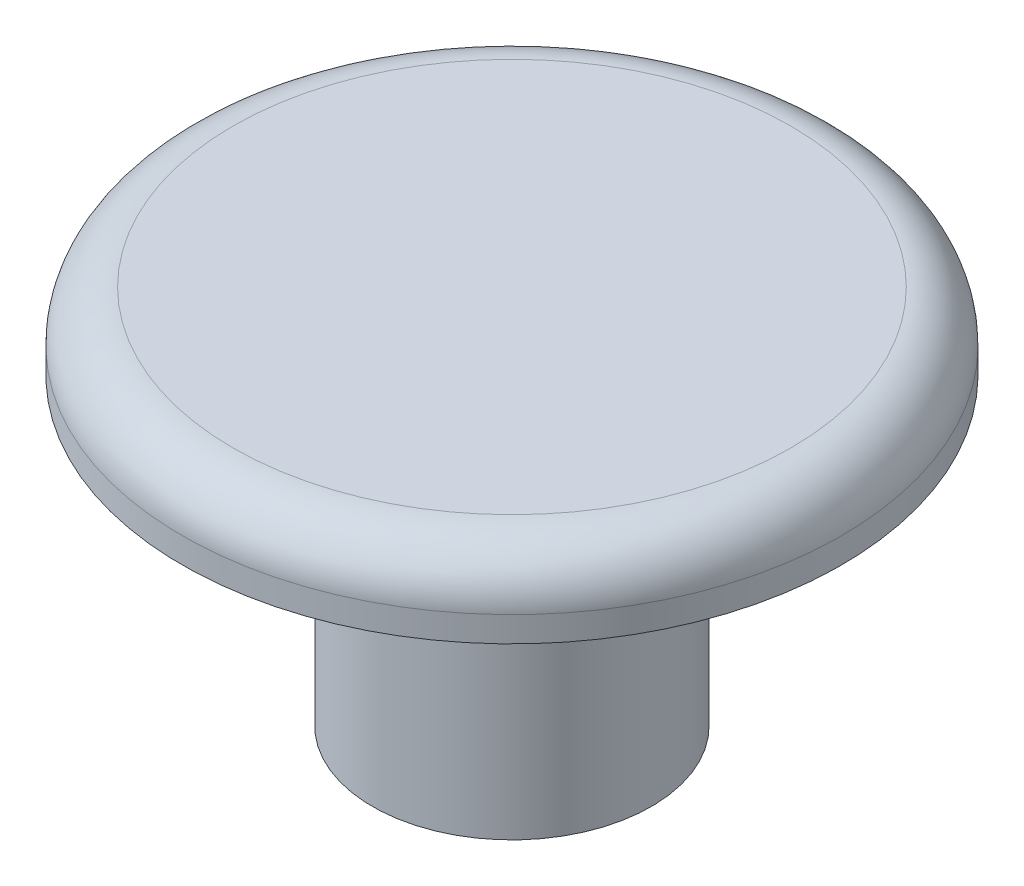
from build123d import *


with BuildPart() as part:
    # Sketch1 → Revolve1 (revolve)
    with BuildSketch(Plane.XY, mode=Mode.PRIVATE) as revolve1_sk:
        with BuildLine():
            Line((0, 15), (11, 15))
            ThreePointArc((11, 15), (12.414213562, 14.414213562), (13, 13))
            Line((13, 13), (13, 12))
            Line((13, 12), (5.5, 12))
            Line((5.5, 12), (5.5, 0))
            Line((5.5, 0), (0, 0))
            Line((0, 0), (0, 15))
        make_face()
    revolve(revolve1_sk.sketch.rotate(Axis((0, 0, 0), (0, 1, 0)), 90), axis=Axis((0, 0, 0), (0, 1, 0)))


solid = part.part
